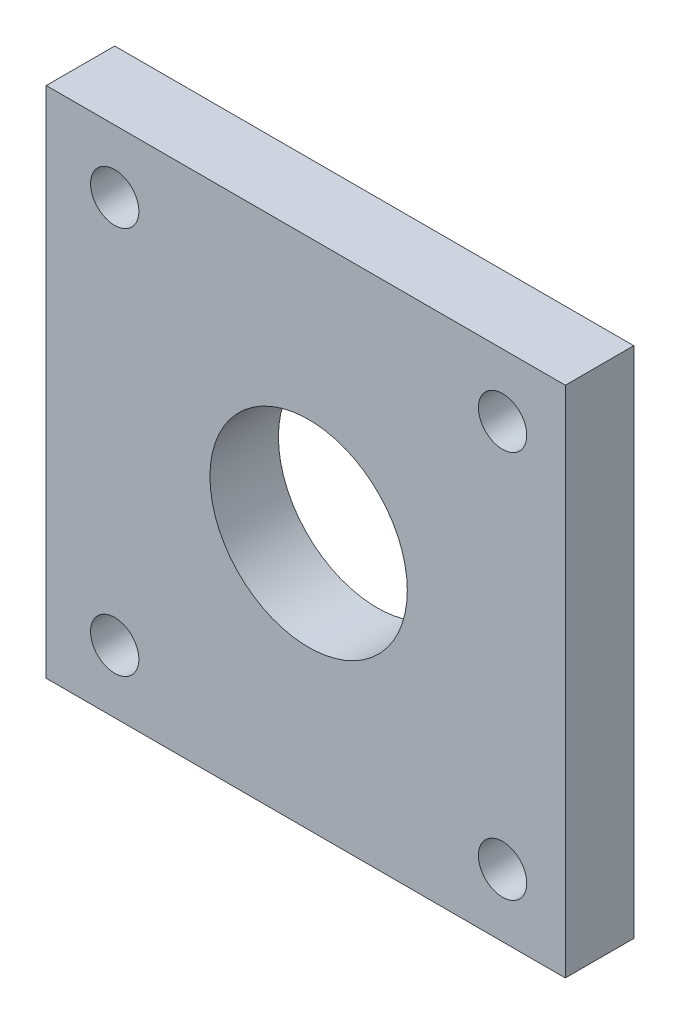
from build123d import *

# Parameters (mm, degrees)
SKETCH1_W                                     = 45.5
SKETCH1_H                                     = 45
SKETCH1_R                                     = 8.65
SKETCH1_R_2                                   = 2.12
SIX_MM_HEAD_PLATE_BOLTS_TO_34_MM_SQUARE_DEPTH = 6
MOUNTING_START                                = -23
SKETCH2_R                                     = 2.12
MOUNTING_TOE_TAPPED_FROM_BOTTOM_DEPTH         = 7


with BuildPart() as part:
    # Sketch1 → Six mm head plate bolts to 34 mm square pattern (new body)
    with BuildSketch(Plane.XY):
        with Locations((-0.25, 0)):
            Rectangle(SKETCH1_W, SKETCH1_H)
        Circle(SKETCH1_R, mode=Mode.SUBTRACT)
        with Locations((-17, -17)):
            Circle(SKETCH1_R_2, mode=Mode.SUBTRACT)
        with Locations((-17, 17)):
            Circle(SKETCH1_R_2, mode=Mode.SUBTRACT)
        with Locations((17, -17)):
            Circle(SKETCH1_R_2, mode=Mode.SUBTRACT)
        with Locations((17, 17)):
            Circle(SKETCH1_R_2, mode=Mode.SUBTRACT)
    extrude(amount=SIX_MM_HEAD_PLATE_BOLTS_TO_34_MM_SQUARE_DEPTH)

    # Sketch2 → Mounting toe tapped from bottom (cut)
    with BuildSketch(Plane(origin=(0, 0, 0), x_dir=(0, 0, -1), z_dir=(1, 0, 0)).offset(MOUNTING_START)):
        with Locations((-3, -9)):
            Circle(SKETCH2_R)
        with Locations((-3, 9)):
            Circle(SKETCH2_R)
    extrude(amount=MOUNTING_TOE_TAPPED_FROM_BOTTOM_DEPTH, mode=Mode.SUBTRACT)


solid = part.part
